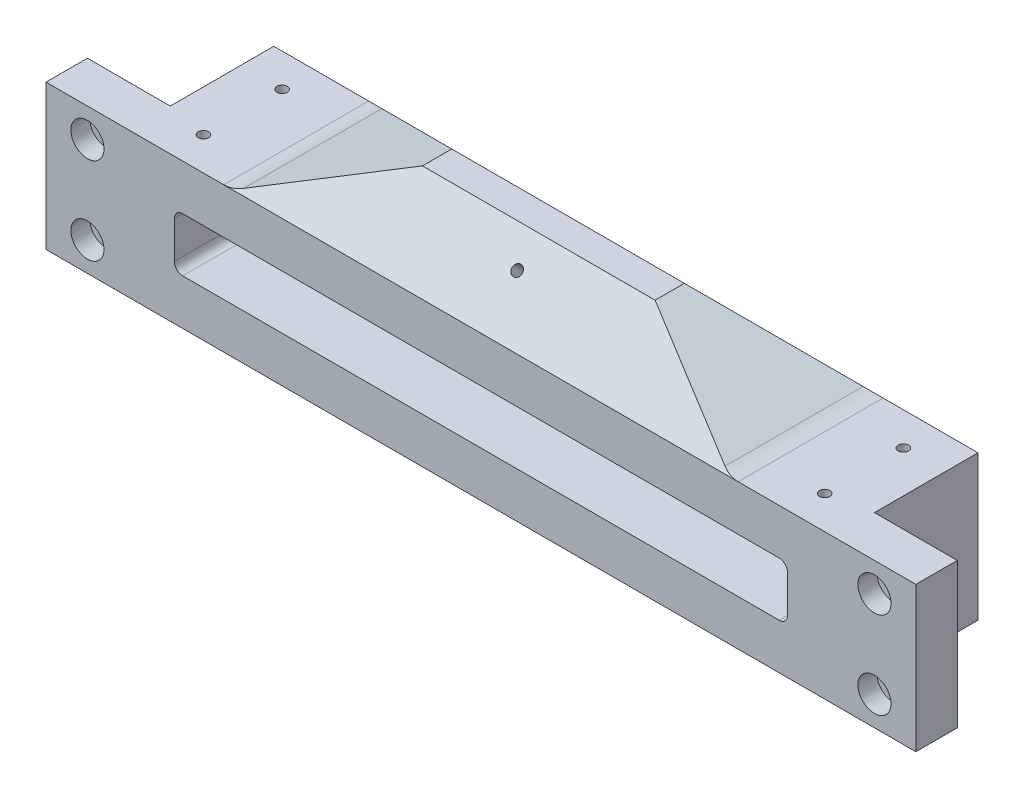
from build123d import *

# Parameters (mm, degrees)
BOSS_EXTRUDE1_START                                  = -85
BOSS_EXTRUDE1_DEPTH                                  = 170
CUT_EXTRUDE2_START                                   = -17.5
SKETCH1_W                                            = 160
SKETCH1_H                                            = 25
CUT_EXTRUDE2_DEPTH                                   = 3
CUT_EXTRUDE4_DEPTH                                   = 98.334474879
CUT_EXTRUDE4_DEPTH_BACK                              = 98.334474879
SKETCH7_W                                            = 148
SKETCH7_H                                            = 13
CUT_EXTRUDE3_DEPTH                                   = 99.361577865
FILLET1_R                                            = 3
FILLET2_R                                            = 10
TAP_DRILL_FOR_M2_TAP1_AT_2_COUNT                     = 2
TAP_DRILL_FOR_M2_TAP1_AT_2_PITCH                     = 38.5
TAP_DRILL_FOR_M2_TAP1_AT_3_COUNT                     = 2
TAP_DRILL_FOR_M2_TAP1_AT_3_PITCH                     = 77
TAP_DRILL_FOR_M2_TAP1_AT_4_COUNT                     = 2
TAP_DRILL_FOR_M2_TAP1_AT_4_PITCH                     = 9.5
M3_TAPPED_HOLE1_AT_2_COUNT                           = 2
M3_TAPPED_HOLE1_AT_2_PITCH                           = 19
CHAMFER1_SIZE                                        = 5
FILLET3_R                                            = 2
TAP_DRILL_FOR_M3_TAP4_D                              = 2.5
TAP_DRILL_FOR_M3_TAP4_DEPTH                          = 5
TAP_DRILL_FOR_M3_TAP4_TIP                            = 0.751075774
SKETCH20_W                                           = 20
SKETCH20_H                                           = 35
BOSS_EXTRUDE2_DEPTH                                  = 10
CBORE_FOR_M4_HEXAGON_SOCKET_HEAD_CAP_SCR_D           = 4.5
CBORE_FOR_M4_HEXAGON_SOCKET_HEAD_CAP_SCR_CBORE_D     = 8
CBORE_FOR_M4_HEXAGON_SOCKET_HEAD_CAP_SCR_CBORE_DEPTH = 4.6


with BuildPart() as part:
    # Sketch2 → Boss-Extrude1 (new body)
    with BuildSketch(Plane(origin=(0, 0, 0), x_dir=(0, 0, -1), z_dir=(1, 0, 0)).offset(BOSS_EXTRUDE1_START)):
        Polygon((17.5, -17.5), (17.5, 0), (-8.75, 26.25), (-17.5, 17.5), (-17.5, -17.5), align=None)
        Polygon((-8.75, 26.25), (17.5, 0), (17.5, 17.5), (0, 35), align=None)
    extrude(amount=BOSS_EXTRUDE1_DEPTH)

    # Sketch1 → Cut-Extrude2 (cut)
    with BuildSketch(Plane.XY.offset(CUT_EXTRUDE2_START)):
        Rectangle(SKETCH1_W, SKETCH1_H)
    extrude(amount=CUT_EXTRUDE2_DEPTH, mode=Mode.SUBTRACT)

    # Sketch7 → Cut-Extrude4 (cut, two sides: drawn at the far end of the back side and taken through both)
    with BuildSketch(Plane(origin=(0, 0, -14.5), x_dir=(-1, 0, 0), z_dir=(0, 0, -1)).offset(-CUT_EXTRUDE4_DEPTH_BACK)):
        Rectangle(SKETCH7_W, SKETCH7_H)
    extrude(amount=CUT_EXTRUDE4_DEPTH + CUT_EXTRUDE4_DEPTH_BACK, mode=Mode.SUBTRACT)

    # Sketch5 → Cut-Extrude3 (cut, symmetric)
    with BuildSketch(Plane(origin=(0, 0, -17.5), x_dir=(-1, 0, 0), z_dir=(0, 0, -1))):
        Polygon((-85, 17.5), (-60, 17.5), (-20, 35), (-85, 35), align=None)
    cut_extrude3 = extrude(amount=CUT_EXTRUDE3_DEPTH, both=True, mode=Mode.SUBTRACT)

    # Mirror1: Cut-Extrude3 across plane
    add(cut_extrude3.mirror(Plane(origin=(0, 0, 0), x_dir=(0, 0, 1), z_dir=(1, 0, 0))), mode=Mode.SUBTRACT)

    # Fillet1
    fillet1_edges = [part.edges().sort_by_distance(p)[0] for p in [
        (80, 12.5, -16),
        (-80, 12.5, -16),
        (-80, -12.5, -16),
        (80, -12.5, -16),
    ]]
    fillet(fillet1_edges, radius=FILLET1_R)

    # Fillet2
    fillet2_edges = [part.edges().sort_by_distance(p)[0] for p in [
        (60, 17.5, 0),
        (-60, 17.5, 0),
    ]]
    fillet(fillet2_edges, radius=FILLET2_R)

    # Sketch11 → Tap Drill for M2 Tap1 (revolve, cut)
    with BuildSketch(Plane(origin=(77, 9.5, -14.5), x_dir=(0, 1, 0), z_dir=(1, 0, 0))):
        Polygon((0, 0), (0, 5.480688495), (0.8, 5), (0.8, 0), align=None)
    tap_drill_for_m2_tap1 = revolve(axis=Axis((77, 9.5, -20.85), (0, 0, 1)), mode=Mode.SUBTRACT)

    # Tap Drill for M2 Tap1 at 2: Tap Drill for M2 Tap1 ×2
    with Locations(*[(-i * TAP_DRILL_FOR_M2_TAP1_AT_2_PITCH, 0, 0) for i in range(1, TAP_DRILL_FOR_M2_TAP1_AT_2_COUNT)]):
        add(tap_drill_for_m2_tap1, mode=Mode.SUBTRACT)

    # Tap Drill for M2 Tap1 at 3: Tap Drill for M2 Tap1 ×2
    with Locations(*[(-i * TAP_DRILL_FOR_M2_TAP1_AT_3_PITCH, 0, 0) for i in range(1, TAP_DRILL_FOR_M2_TAP1_AT_3_COUNT)]):
        add(tap_drill_for_m2_tap1, mode=Mode.SUBTRACT)

    # Tap Drill for M2 Tap1 at 4: Tap Drill for M2 Tap1 ×2
    with Locations(*[(0, -i * TAP_DRILL_FOR_M2_TAP1_AT_4_PITCH, 0) for i in range(1, TAP_DRILL_FOR_M2_TAP1_AT_4_COUNT)]):
        add(tap_drill_for_m2_tap1, mode=Mode.SUBTRACT)

    # Mirror3: Tap Drill for M2 Tap1 across plane
    add(tap_drill_for_m2_tap1.mirror(Plane(origin=(0, 0, 0), x_dir=(0, 0, 1), z_dir=(1, 0, 0))), mode=Mode.SUBTRACT)

    # Mirror3 copy 1 sketch → Mirror3 copy 1 (revolve, cut)
    with BuildSketch(Plane(origin=(-38.5, 9.5, -14.5), x_dir=(0, 1, 0), z_dir=(-1, 0, 0))):
        Polygon((0, 0), (0, -5.480688495), (0.8, -5), (0.8, 0), align=None)
    revolve(axis=Axis((-38.5, 9.5, -20.85), (0, 0, -1)), mode=Mode.SUBTRACT)

    # Mirror3 copy 2 sketch → Mirror3 copy 2 (revolve, cut)
    with BuildSketch(Plane(origin=(0, 9.5, -14.5), x_dir=(0, 1, 0), z_dir=(-1, 0, 0))):
        Polygon((0, 0), (0, -5.480688495), (0.8, -5), (0.8, 0), align=None)
    revolve(axis=Axis((0, 9.5, -20.85), (0, 0, -1)), mode=Mode.SUBTRACT)

    # Mirror3 copy 3 sketch → Mirror3 copy 3 (revolve, cut)
    with BuildSketch(Plane(origin=(-77, 0, -14.5), x_dir=(0, 1, 0), z_dir=(-1, 0, 0))):
        Polygon((0, 0), (0, -5.480688495), (0.8, -5), (0.8, 0), align=None)
    revolve(axis=Axis((-77, 0, -20.85), (0, 0, -1)), mode=Mode.SUBTRACT)

    # Mirror3 at the second plane: Tap Drill for M2 Tap1 across plane
    add(tap_drill_for_m2_tap1.mirror(Plane.ZX), mode=Mode.SUBTRACT)

    # Mirror3 at the second plane copy 1 sketc → Mirror3 at the second plane copy 1 (revolve, cut)
    with BuildSketch(Plane(origin=(38.5, -9.5, -14.5), x_dir=(0, -1, 0), z_dir=(1, 0, 0))):
        Polygon((0, 0), (0, -5.480688495), (0.8, -5), (0.8, 0), align=None)
    revolve(axis=Axis((38.5, -9.5, -20.85), (0, 0, -1)), mode=Mode.SUBTRACT)

    # Mirror3 at the second plane copy 2 sketc → Mirror3 at the second plane copy 2 (revolve, cut)
    with BuildSketch(Plane(origin=(0, -9.5, -14.5), x_dir=(0, -1, 0), z_dir=(1, 0, 0))):
        Polygon((0, 0), (0, -5.480688495), (0.8, -5), (0.8, 0), align=None)
    revolve(axis=Axis((0, -9.5, -20.85), (0, 0, -1)), mode=Mode.SUBTRACT)

    # Mirror3 at the second plane copy 3 sketc → Mirror3 at the second plane copy 3 (revolve, cut)
    with BuildSketch(Plane(origin=(77, 0, -14.5), x_dir=(0, -1, 0), z_dir=(1, 0, 0))):
        Polygon((0, 0), (0, -5.480688495), (0.8, -5), (0.8, 0), align=None)
    revolve(axis=Axis((77, 0, -20.85), (0, 0, -1)), mode=Mode.SUBTRACT)

    # Mirror3 at the second plane copy 4 sketc → Mirror3 at the second plane copy 4 (revolve, cut)
    with BuildSketch(Plane(origin=(-77, -9.5, -14.5), x_dir=(0, -1, 0), z_dir=(-1, 0, 0))):
        Polygon((0, 0), (0, 5.480688495), (0.8, 5), (0.8, 0), align=None)
    revolve(axis=Axis((-77, -9.5, -20.85), (0, 0, 1)), mode=Mode.SUBTRACT)

    # Mirror3 at the second plane copy 5 sketc → Mirror3 at the second plane copy 5 (revolve, cut)
    with BuildSketch(Plane(origin=(-38.5, -9.5, -14.5), x_dir=(0, -1, 0), z_dir=(-1, 0, 0))):
        Polygon((0, 0), (0, 5.480688495), (0.8, 5), (0.8, 0), align=None)
    revolve(axis=Axis((-38.5, -9.5, -20.85), (0, 0, 1)), mode=Mode.SUBTRACT)

    # Mirror3 at the second plane copy 6 sketc → Mirror3 at the second plane copy 6 (revolve, cut)
    with BuildSketch(Plane(origin=(0, -9.5, -14.5), x_dir=(0, -1, 0), z_dir=(-1, 0, 0))):
        Polygon((0, 0), (0, 5.480688495), (0.8, 5), (0.8, 0), align=None)
    revolve(axis=Axis((0, -9.5, -20.85), (0, 0, 1)), mode=Mode.SUBTRACT)

    # Mirror3 at the second plane copy 7 sketc → Mirror3 at the second plane copy 7 (revolve, cut)
    with BuildSketch(Plane(origin=(-77, 0, -14.5), x_dir=(0, -1, 0), z_dir=(-1, 0, 0))):
        Polygon((0, 0), (0, 5.480688495), (0.8, 5), (0.8, 0), align=None)
    revolve(axis=Axis((-77, 0, -20.85), (0, 0, 1)), mode=Mode.SUBTRACT)

    # Sketch14 → M3 Tapped Hole1 (revolve, cut)
    with BuildSketch(Plane(origin=(-75, 17.5, -9.5), x_dir=(0, 0, 1), z_dir=(1, 0, 0))):
        Polygon((0, 0), (0, 8.751075774), (1.25, 8), (1.25, 0), align=None)
    m3_tapped_hole1 = revolve(axis=Axis((-75, 23.85, -9.5), (0, -1, 0)), mode=Mode.SUBTRACT)

    # M3 Tapped Hole1 at 2: M3 Tapped Hole1 ×2
    with Locations(*[(0, 0, i * M3_TAPPED_HOLE1_AT_2_PITCH) for i in range(1, M3_TAPPED_HOLE1_AT_2_COUNT)]):
        add(m3_tapped_hole1, mode=Mode.SUBTRACT)

    # Mirror4: M3 Tapped Hole1 across plane
    add(m3_tapped_hole1.mirror(Plane.ZX), mode=Mode.SUBTRACT)

    # Mirror4 copy 1 sketch → Mirror4 copy 1 (revolve, cut)
    with BuildSketch(Plane(origin=(-75, -17.5, 9.5), x_dir=(0, 0, 1), z_dir=(1, 0, 0))):
        Polygon((0, 0), (0, -8.751075774), (1.25, -8), (1.25, 0), align=None)
    revolve(axis=Axis((-75, -23.85, 9.5), (0, -1, 0)), mode=Mode.SUBTRACT)

    # Mirror4 at the second plane: M3 Tapped Hole1 across plane
    add(m3_tapped_hole1.mirror(Plane(origin=(0, 0, 0), x_dir=(0, 0, 1), z_dir=(1, 0, 0))), mode=Mode.SUBTRACT)

    # Mirror4 at the second plane copy 1 sketc → Mirror4 at the second plane copy 1 (revolve, cut)
    with BuildSketch(Plane(origin=(75, 17.5, 9.5), x_dir=(0, 0, 1), z_dir=(-1, 0, 0))):
        Polygon((0, 0), (0, -8.751075774), (1.25, -8), (1.25, 0), align=None)
    revolve(axis=Axis((75, 23.85, 9.5), (0, 1, 0)), mode=Mode.SUBTRACT)

    # Mirror4 at the second plane copy 2 sketc → Mirror4 at the second plane copy 2 (revolve, cut)
    with BuildSketch(Plane(origin=(75, -17.5, -9.5), x_dir=(0, 0, 1), z_dir=(-1, 0, 0))):
        Polygon((0, 0), (0, 8.751075774), (1.25, 8), (1.25, 0), align=None)
    revolve(axis=Axis((75, -23.85, -9.5), (0, 1, 0)), mode=Mode.SUBTRACT)

    # Mirror4 at the second plane copy 3 sketc → Mirror4 at the second plane copy 3 (revolve, cut)
    with BuildSketch(Plane(origin=(75, -17.5, 9.5), x_dir=(0, 0, 1), z_dir=(-1, 0, 0))):
        Polygon((0, 0), (0, 8.751075774), (1.25, 8), (1.25, 0), align=None)
    revolve(axis=Axis((75, -23.85, 9.5), (0, 1, 0)), mode=Mode.SUBTRACT)

    # Chamfer1
    chamfer1_edges = [part.edges().sort_by_distance(p)[0] for p in [
        (0, 35, 0),
    ]]
    chamfer(chamfer1_edges, length=CHAMFER1_SIZE)

    # Fillet3
    fillet3_edges = [part.edges().sort_by_distance(p)[0] for p in [
        (74, -6.5, 1.5),
        (74, 6.5, 1.5),
        (-74, 6.5, 1.5),
        (-74, -6.5, 1.5),
    ]]
    fillet(fillet3_edges, radius=FILLET3_R)

    # Tap Drill for M3 Tap4
    with Locations(Plane(origin=(0, 17.5, 17.5), x_dir=(1, 0, 0), z_dir=(0, 0.7071067811865487, 0.7071067811865465))):
        with Locations((0, 12.374368671)):
            Hole(TAP_DRILL_FOR_M3_TAP4_D / 2, depth=TAP_DRILL_FOR_M3_TAP4_DEPTH)
            with Locations((0, 0, -(TAP_DRILL_FOR_M3_TAP4_DEPTH + TAP_DRILL_FOR_M3_TAP4_TIP / 2))):  # 118° drill point
                Cone(0, TAP_DRILL_FOR_M3_TAP4_D / 2, TAP_DRILL_FOR_M3_TAP4_TIP, mode=Mode.SUBTRACT)

    # Sketch20 → Boss-Extrude2 (add)
    with BuildSketch(Plane(origin=(0, 0, 17.5), x_dir=(-1, 0, 0), z_dir=(0, 0, -1))):
        with Locations((-95, 0)):
            Rectangle(SKETCH20_W, SKETCH20_H)
    boss_extrude2 = extrude(amount=BOSS_EXTRUDE2_DEPTH)

    # CBORE for M4 Hexagon socket head cap screws1 (through all)
    with Locations(Plane.XY.offset(17.5)):
        with Locations((95, 10.5), (95, -10.5)):
            cbore_for_m4_hexagon_socket_head_cap_scr = CounterBoreHole(CBORE_FOR_M4_HEXAGON_SOCKET_HEAD_CAP_SCR_D / 2, CBORE_FOR_M4_HEXAGON_SOCKET_HEAD_CAP_SCR_CBORE_D / 2, CBORE_FOR_M4_HEXAGON_SOCKET_HEAD_CAP_SCR_CBORE_DEPTH)

    # Mirror5: Boss-Extrude2, CBORE for M4 Hexagon socket head cap screws1 across plane
    add(boss_extrude2.mirror(Plane(origin=(0, 0, 0), x_dir=(0, 0, 1), z_dir=(1, 0, 0))))
    add(cbore_for_m4_hexagon_socket_head_cap_scr.mirror(Plane(origin=(0, 0, 0), x_dir=(0, 0, 1), z_dir=(1, 0, 0))), mode=Mode.SUBTRACT)


solid = part.part
